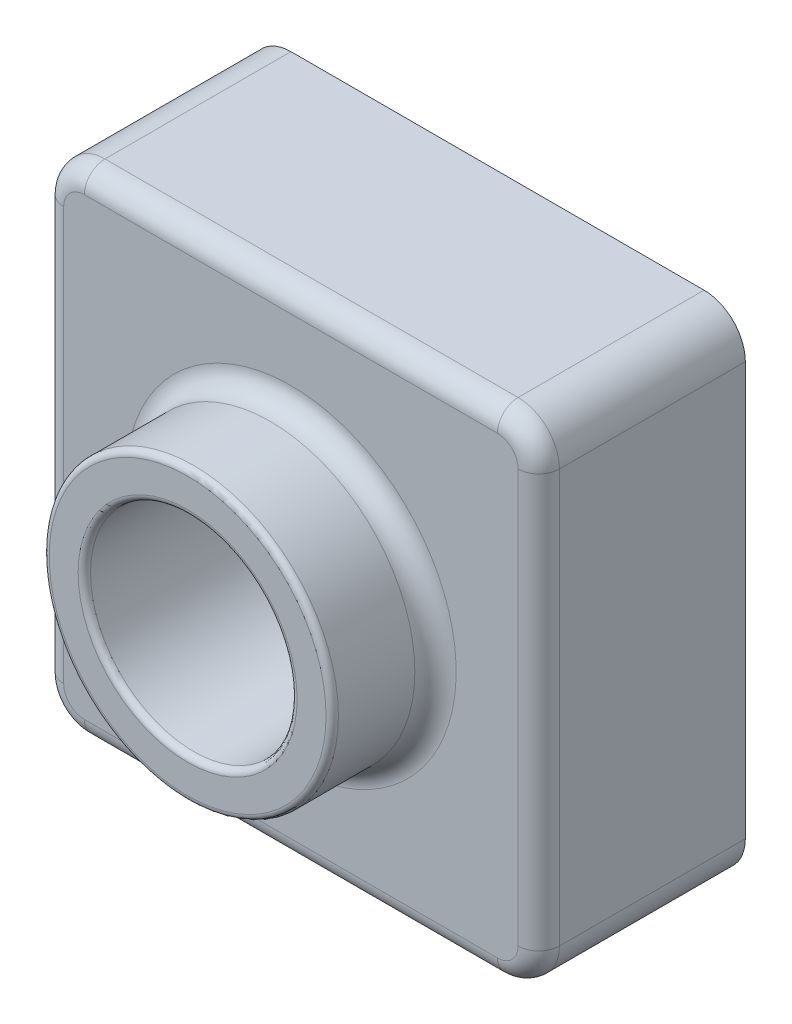
from build123d import *

# Parameters (mm, degrees)
SKETCH_1_W          = 120
SKETCH_1_H          = 120
EXTRUDE_1_DEPTH     = 50
SKETCH_2_R          = 35
EXTRUDE_2_DEPTH     = 25
SKETCH_3_R          = 25
CUT_EXTRUDE_1_DEPTH = 186.539753153
FILLET_1_R          = 10
FILLET_2_R          = 1.5
FILLET_3_R          = 5
SHELL_1_T           = -2


with BuildPart() as part:
    # 草图1 → 凸台-拉伸1 (new body)
    with BuildSketch(Plane.XY):
        with Locations((60, 60)):
            Rectangle(SKETCH_1_W, SKETCH_1_H)
    extrude(amount=EXTRUDE_1_DEPTH)

    # 草图2 → 凸台-拉伸2 (add)
    with BuildSketch(Plane.XY.offset(50)):
        with Locations((60, 60)):
            Circle(SKETCH_2_R)
    extrude(amount=EXTRUDE_2_DEPTH)

    # 草图3 → 切除-拉伸1 (cut, through all)
    with BuildSketch(Plane.XY.offset(75)):
        with Locations((60, 60)):
            Circle(SKETCH_3_R)
    extrude(amount=-CUT_EXTRUDE_1_DEPTH, mode=Mode.SUBTRACT)

    # 圆角1
    fillet_1_edges = [part.edges().sort_by_distance(p)[0] for p in [
        (0, 120, 25),
        (120, 120, 25),
        (120, 0, 25),
        (0, 0, 25),
    ]]
    fillet(fillet_1_edges, radius=FILLET_1_R)

    # 圆角2
    fillet_2_edges = [part.edges().sort_by_distance(p)[0] for p in [
        (25, 60, 75),
        (35, 60, 75),
    ]]
    fillet(fillet_2_edges, radius=FILLET_2_R)

    # 圆角3
    fillet_3_edges = [part.edges().sort_by_distance(p)[0] for p in [
        (25, 60, 50),
        (0, 60, 50),
        (60, 120, 50),
        (60, 0, 50),
        (120, 60, 50),
        (117.071067812, 117.071067812, 50),
        (117.071067812, 2.928932188, 50),
        (2.928932188, 2.928932188, 50),
        (2.928932188, 117.071067812, 50),
    ]]
    fillet(fillet_3_edges, radius=FILLET_3_R)

    # 抽壳1
    shell_1_openings = [part.faces().sort_by_distance(p)[0] for p in [
        (60, 1.697056275, 0),
    ]]
    offset(amount=SHELL_1_T, openings=shell_1_openings, kind=Kind.INTERSECTION)


solid = part.part
